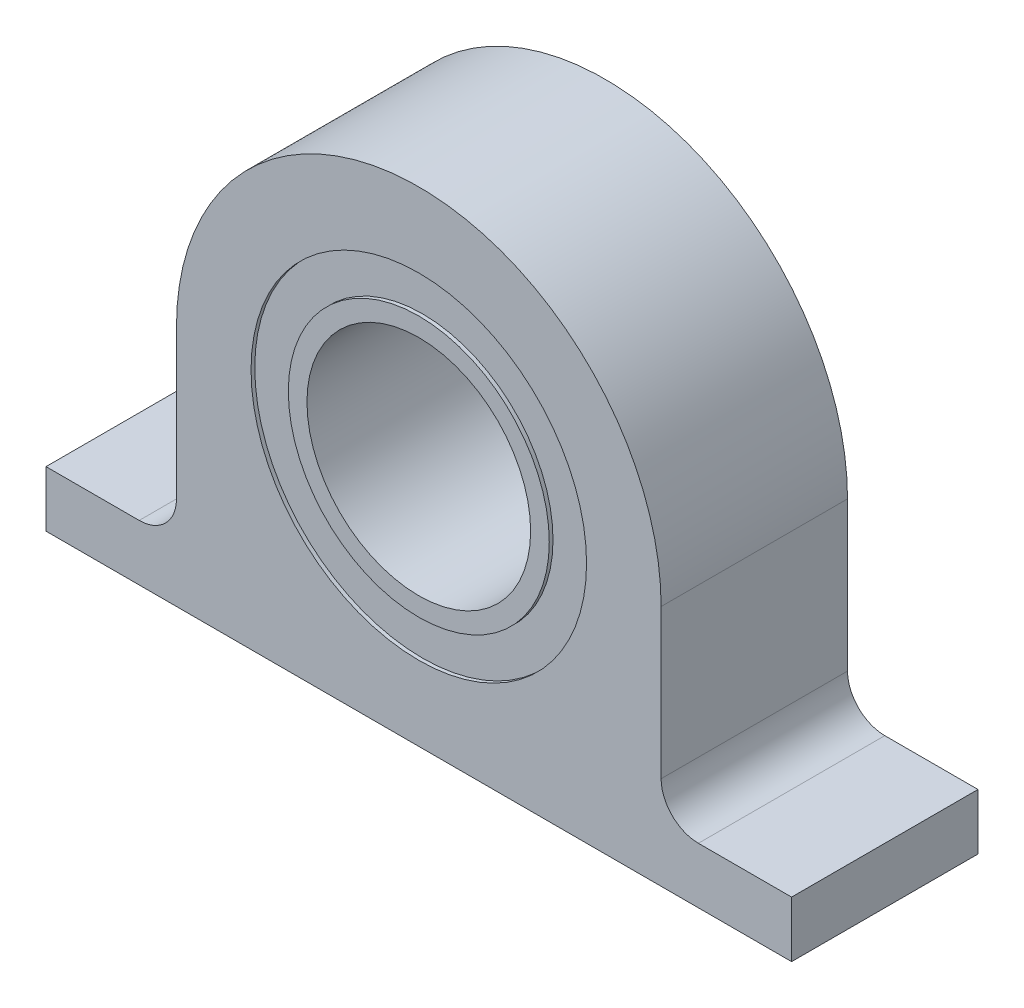
from build123d import *

# Parameters (mm, degrees)
SKETCH1_R           = 12.7
SKETCH1_R_2         = 7.62
BOSS_EXTRUDE1_DEPTH = 12.7
SKETCH2_R           = 11.43
SKETCH2_R_2         = 8.89
CUT_EXTRUDE1_DEPTH  = 0.254
SKETCH3_R           = 12.7
BOSS_EXTRUDE3_DEPTH = 12.7


with BuildPart() as part:
    # Sketch1 → Boss-Extrude1 (new body)
    with BuildSketch(Plane.XY):
        Circle(SKETCH1_R)
        Circle(SKETCH1_R_2, mode=Mode.SUBTRACT)
    extrude(amount=BOSS_EXTRUDE1_DEPTH)

    # Sketch2 → Cut-Extrude1 (cut)
    with BuildSketch(Plane.XY.offset(12.7)):
        Circle(SKETCH2_R)
        Circle(SKETCH2_R_2, mode=Mode.SUBTRACT)
    cut_extrude1 = extrude(amount=-CUT_EXTRUDE1_DEPTH, mode=Mode.SUBTRACT)

    # Mirror1: Cut-Extrude1 across plane
    add(cut_extrude1.mirror(Plane.XY.offset(6.35)), mode=Mode.SUBTRACT)

    # Sketch3 → Boss-Extrude3 (add)
    with BuildSketch(Plane.XY):
        with BuildLine():
            Line((-25.4, -16.51), (25.4, -16.51))
            Line((25.4, -16.51), (25.4, -12.7))
            Line((25.4, -12.7), (19.05, -12.7))
            ThreePointArc((19.05, -12.7), (17.253948776, -11.956051224), (16.51, -10.16))
            Line((16.51, -10.16), (16.51, 0))
            ThreePointArc((16.51, 0), (0, 16.51), (-16.51, 0))
            Line((-16.51, 0), (-16.51, -10.16))
            ThreePointArc((-16.51, -10.16), (-17.253948776, -11.956051224), (-19.05, -12.7))
            Line((-19.05, -12.7), (-25.4, -12.7))
            Line((-25.4, -12.7), (-25.4, -16.51))
        make_face()
        Circle(SKETCH3_R, mode=Mode.SUBTRACT)
    extrude(amount=BOSS_EXTRUDE3_DEPTH)


solid = part.part
